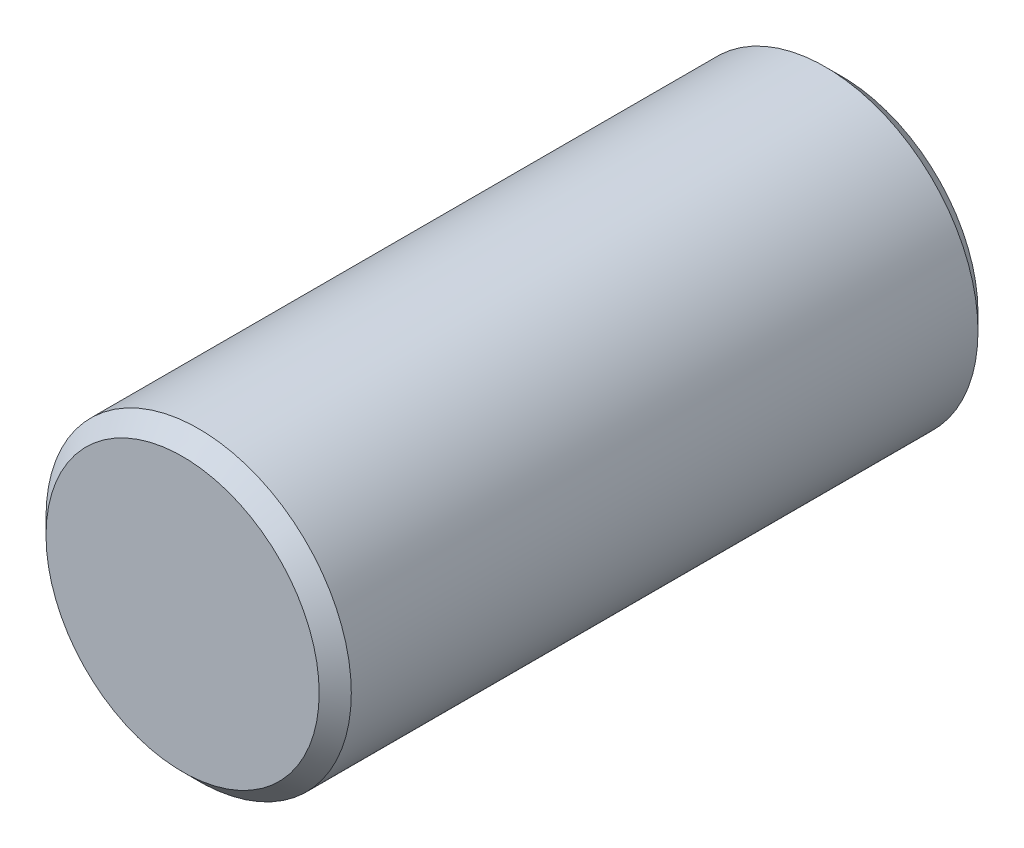
from build123d import *

# Parameters (mm, degrees)
SKETCH1_R           = 19
BOSS_EXTRUDE1_DEPTH = 41
CHAMFER1_SIZE       = 2


with BuildPart() as part:
    # Sketch1 → Boss-Extrude1 (new, symmetric)
    with BuildSketch(Plane.XY):
        Circle(SKETCH1_R)
    extrude(amount=BOSS_EXTRUDE1_DEPTH, both=True)

    # Chamfer1
    chamfer1_edges = [part.edges().sort_by_distance(p)[0] for p in [
        (-19, 0, -41),
        (-19, 0, 41),
    ]]
    chamfer(chamfer1_edges, length=CHAMFER1_SIZE)


solid = part.part
